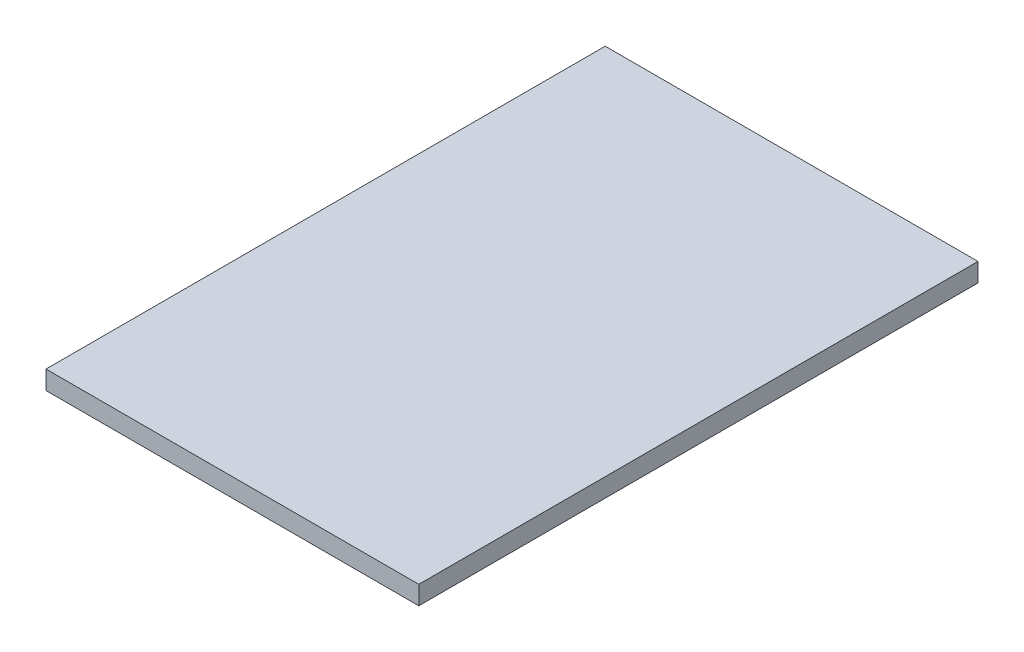
from build123d import *

# Parameters (mm, degrees)
ESBO_O1_W                = 20
ESBO_O1_H                = 30
RESSALTO_EXTRUS_O1_DEPTH = 1


with BuildPart() as part:
    # Esboço1 → Ressalto-extrusão1 (new body)
    with BuildSketch(Plane(origin=(0, 0, 0), x_dir=(1, 0, 0), z_dir=(0, 1, 0))):
        Rectangle(ESBO_O1_W, ESBO_O1_H)
    extrude(amount=RESSALTO_EXTRUS_O1_DEPTH)


solid = part.part
